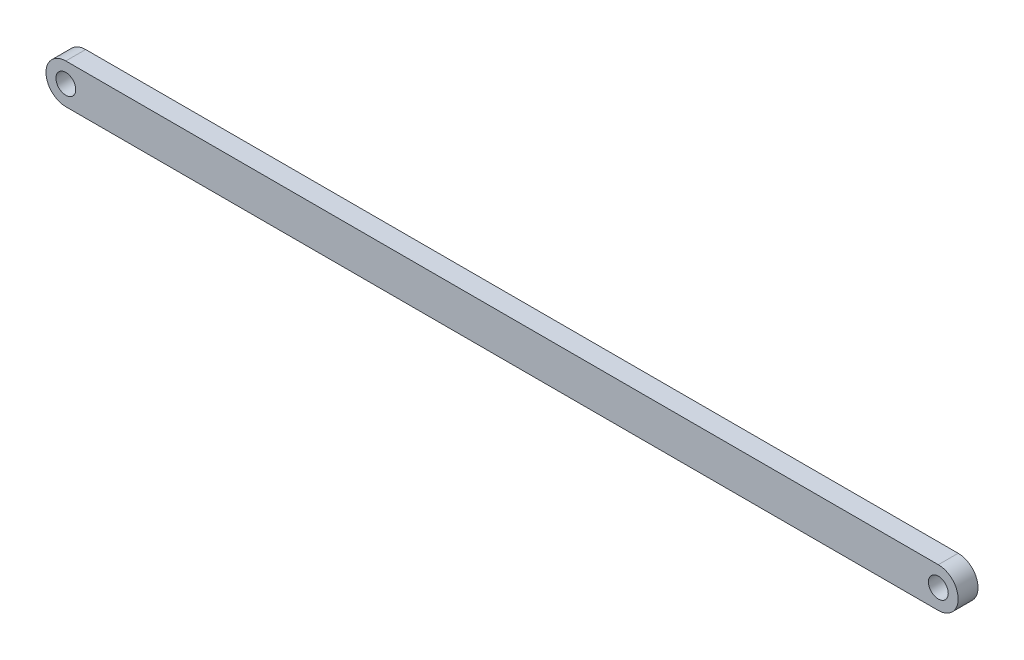
from build123d import *

# Parameters (mm, degrees)
SKETCH_1_R      = 2.5
EXTRUDE_4_DEPTH = 5


with BuildPart() as part:
    # 草图1 → 凸台-拉伸4 (new body)
    with BuildSketch(Plane.XY):
        with BuildLine():
            Line((0, 5), (220, 5))
            ThreePointArc((220, 5), (225, 0), (220, -5))
            Line((220, -5), (0, -5))
            ThreePointArc((0, -5), (-5, 0), (0, 5))
        make_face()
        Circle(SKETCH_1_R, mode=Mode.SUBTRACT)
        with Locations((220, 0)):
            Circle(SKETCH_1_R, mode=Mode.SUBTRACT)
    extrude(amount=EXTRUDE_4_DEPTH)


solid = part.part
